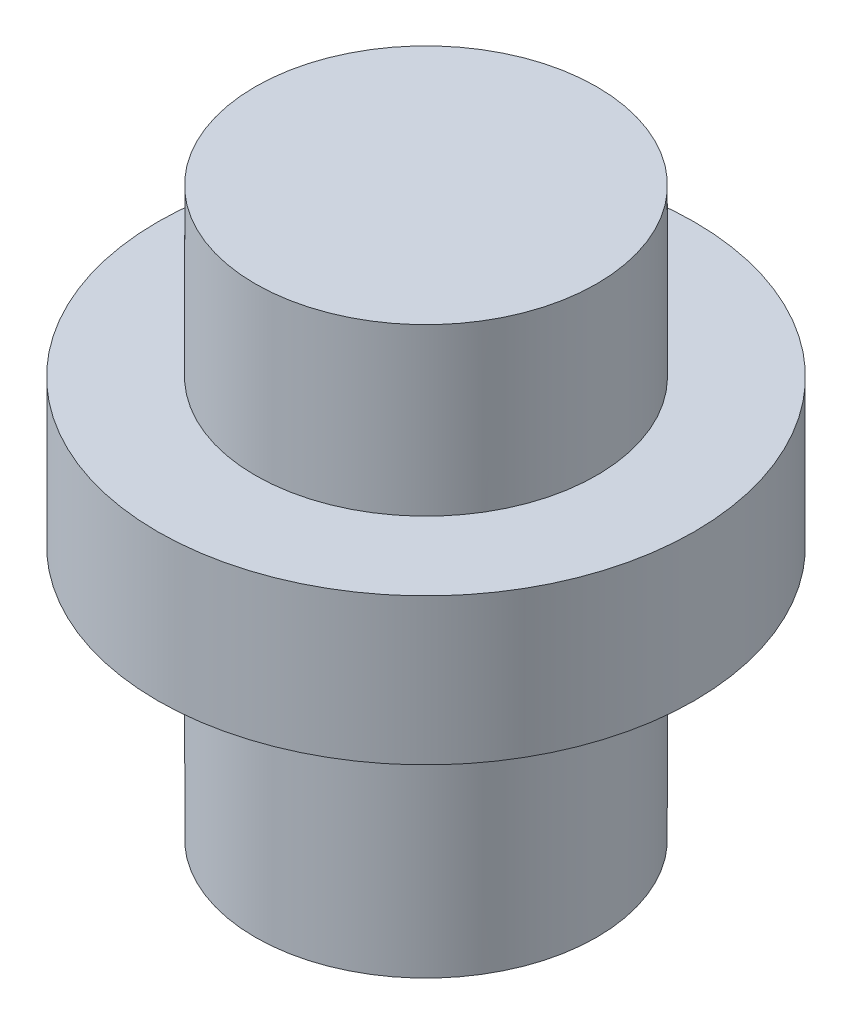
from build123d import *

# Parameters (mm, degrees)
SKETCH_1_R        = 1.75
EXTRUDE_1_DEPTH   = 5.8
SKETCH_2_R        = 2.75
SKETCH_2_R_2      = 1.75
EXTRUDE_1_2_DEPTH = 1.5


with BuildPart() as part:
    # 草图1 → Extrude 1 (new body)
    with BuildSketch(Plane(origin=(0, -8.55, 0), x_dir=(-1, 0, 0), z_dir=(0, -1, 0))):
        with Locations(Location((-13.635514667, 19.62057936, 0), (0, 0, 90))):
            Circle(SKETCH_1_R)
    extrude(amount=EXTRUDE_1_DEPTH)

    # 草图2 → Extrude 1 2 (add)
    with BuildSketch(Plane(origin=(0, -10.25, 0), x_dir=(1, 0, 0), z_dir=(0, 1, 0))):
        with Locations((13.635514667, 19.62057936)):
            Circle(SKETCH_2_R)
        with Locations((13.635514667, 19.62057936)):
            Circle(SKETCH_2_R_2, mode=Mode.SUBTRACT)
    extrude(amount=-EXTRUDE_1_2_DEPTH)


solid = part.part
